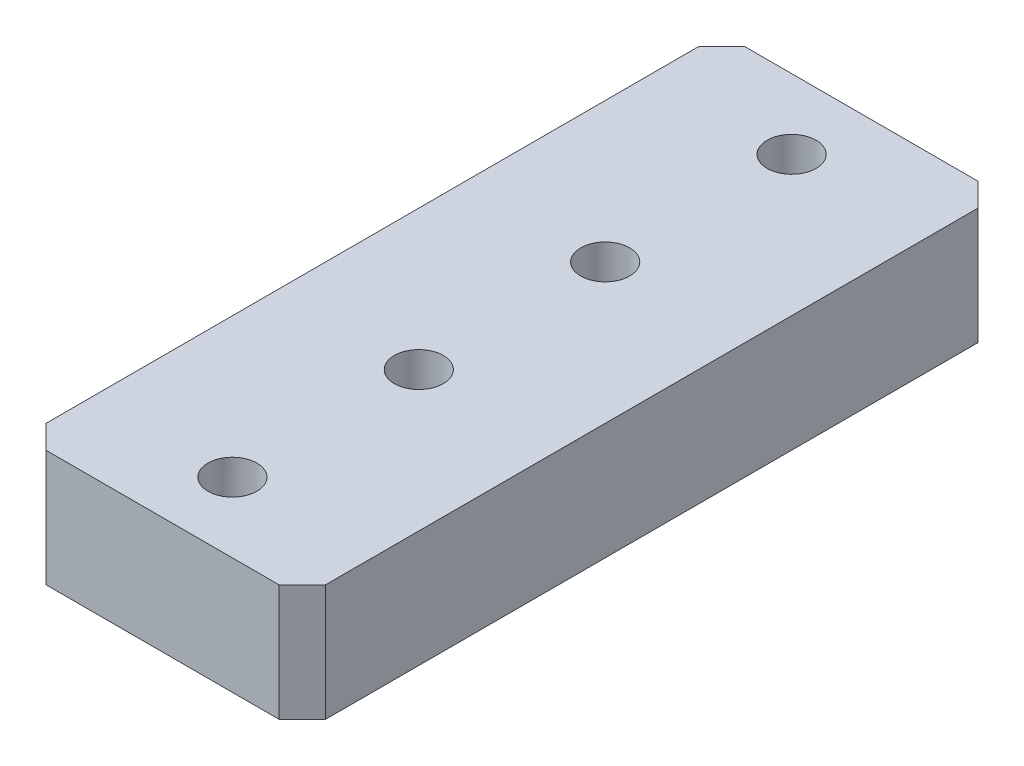
from build123d import *

# Parameters (mm, degrees)
SKETCH_1_W          = 24
SKETCH_1_H          = 60
EXTRUDE_1_DEPTH     = 10
CHAMFER_1_SIZE      = 2
SKETCH_3_R          = 2.1
CUT_EXTRUDE_1_DEPTH = 15
SKETCH_4_R          = 5
CUT_EXTRUDE_2_DEPTH = 6


with BuildPart() as part:
    # 草图1 → 凸台-拉伸1 (new body)
    with BuildSketch(Plane(origin=(0, 0, 0), x_dir=(1, 0, 0), z_dir=(0, 1, 0))):
        Rectangle(SKETCH_1_W, SKETCH_1_H)
    extrude(amount=EXTRUDE_1_DEPTH)

    # 倒角1
    chamfer_1_edges = [part.edges().sort_by_distance(p)[0] for p in [
        (12, 5, 30),
        (-12, 5, 30),
        (-12, 5, -30),
        (12, 5, -30),
    ]]
    chamfer(chamfer_1_edges, length=CHAMFER_1_SIZE)

    # 草图3 → 切除-拉伸1 (cut)
    with BuildSketch(Plane(origin=(0, 10, 0), x_dir=(1, 0, 0), z_dir=(0, 1, 0))):
        with Locations(Location((0, -8, 0), (0, 0, 270))):
            Circle(SKETCH_3_R)
        with Locations(Location((0, 8, 0), (0, 0, 270))):
            Circle(SKETCH_3_R)
        with Locations(Location((0, -24, 0), (0, 0, 270))):
            Circle(SKETCH_3_R)
        with Locations(Location((0, 24, 0), (0, 0, 270))):
            Circle(SKETCH_3_R)
    extrude(amount=-CUT_EXTRUDE_1_DEPTH, mode=Mode.SUBTRACT)

    # 草图4 → 切除-拉伸2 (cut)
    with BuildSketch(Plane.XZ):
        with Locations(Location((0, -24, 0), (0, 0, 270))):
            Circle(SKETCH_4_R)
        with Locations(Location((0, -8, 0), (0, 0, 270))):
            Circle(SKETCH_4_R)
        with Locations(Location((0, 8, 0), (0, 0, 270))):
            Circle(SKETCH_4_R)
        with Locations(Location((0, 24, 0), (0, 0, 270))):
            Circle(SKETCH_4_R)
    extrude(amount=-CUT_EXTRUDE_2_DEPTH, mode=Mode.SUBTRACT)


solid = part.part
